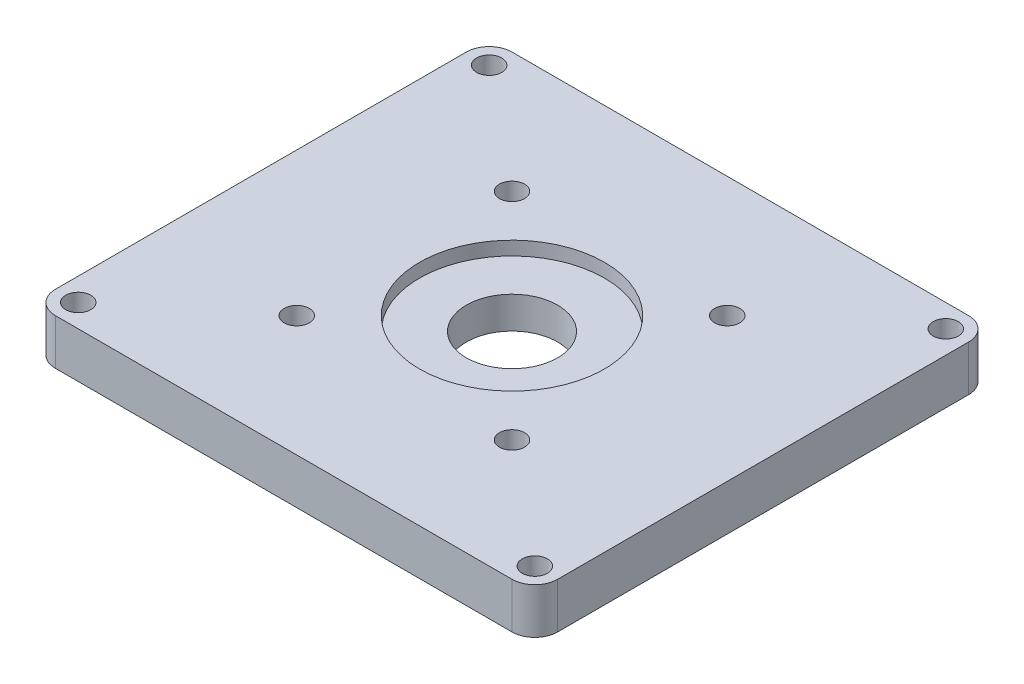
from build123d import *

# Parameters (mm, degrees)
SKETCH2_W           = 110
SKETCH2_H           = 100
SKETCH2_R           = 2.75
BOSS_EXTRUDE1_DEPTH = 10
SKETCH3_R           = 10
CUT_EXTRUDE1_DEPTH  = 10
SKETCH4_R           = 20.25
CUT_EXTRUDE2_DEPTH  = 3
SKETCH5_R           = 6.25
CUT_EXTRUDE3_DEPTH  = 5.5
FILLET1_R           = 5


with BuildPart() as part:
    # Sketch2 → Boss-Extrude1 (new body)
    with BuildSketch(Plane(origin=(0, 0, 0), x_dir=(1, 0, 0), z_dir=(0, 1, 0))):
        with Locations((23.57, 23.57)):
            Rectangle(SKETCH2_W, SKETCH2_H)
        with Locations(Location((0, 47.14, 0), (0, 0, 270))):
            Circle(SKETCH2_R, mode=Mode.SUBTRACT)
        with Locations(Location((47.14, 47.14, 0), (0, 0, 270))):
            Circle(SKETCH2_R, mode=Mode.SUBTRACT)
        with Locations(Location((47.14, 0, 0), (0, 0, 270))):
            Circle(SKETCH2_R, mode=Mode.SUBTRACT)
        with Locations(Location((0, 0, 0), (0, 0, 270))):
            Circle(SKETCH2_R, mode=Mode.SUBTRACT)
        with Locations(Location((-26.43, 68.57, 0), (0, 0, 270))):
            Circle(SKETCH2_R, mode=Mode.SUBTRACT)
        with Locations(Location((73.57, 68.57, 0), (0, 0, 270))):
            Circle(SKETCH2_R, mode=Mode.SUBTRACT)
        with Locations(Location((73.57, -21.43, 0), (0, 0, 270))):
            Circle(SKETCH2_R, mode=Mode.SUBTRACT)
        with Locations(Location((-26.43, -21.43, 0), (0, 0, 270))):
            Circle(SKETCH2_R, mode=Mode.SUBTRACT)
    extrude(amount=BOSS_EXTRUDE1_DEPTH)

    # Sketch3 → Cut-Extrude1 (cut)
    with BuildSketch(Plane(origin=(0, 10, 0), x_dir=(1, 0, 0), z_dir=(0, 1, 0))):
        with Locations(Location((23.57, 23.57, 0), (0, 0, 270))):
            Circle(SKETCH3_R)
    extrude(amount=-CUT_EXTRUDE1_DEPTH, mode=Mode.SUBTRACT)

    # Sketch4 → Cut-Extrude2 (cut)
    with BuildSketch(Plane(origin=(0, 10, 0), x_dir=(1, 0, 0), z_dir=(0, 1, 0))):
        with Locations(Location((23.57, 23.57, 0), (0, 0, 270))):
            Circle(SKETCH4_R)
    extrude(amount=-CUT_EXTRUDE2_DEPTH, mode=Mode.SUBTRACT)

    # Sketch5 → Cut-Extrude3 (cut)
    with BuildSketch(Plane.XZ):
        with Locations(Location((0, 0, 0), (0, 0, 270))):
            Circle(SKETCH5_R)
        with Locations(Location((47.14, 0, 0), (0, 0, 270))):
            Circle(SKETCH5_R)
        with Locations(Location((47.14, -47.14, 0), (0, 0, 270))):
            Circle(SKETCH5_R)
        with Locations(Location((0, -47.14, 0), (0, 0, 270))):
            Circle(SKETCH5_R)
    extrude(amount=-CUT_EXTRUDE3_DEPTH, mode=Mode.SUBTRACT)

    # Fillet1
    fillet1_edges = [part.edges().sort_by_distance(p)[0] for p in [
        (78.57, 5, 26.43),
        (-31.43, 5, 26.43),
        (-31.43, 5, -73.57),
        (78.57, 5, -73.57),
    ]]
    fillet(fillet1_edges, radius=FILLET1_R)


solid = part.part
